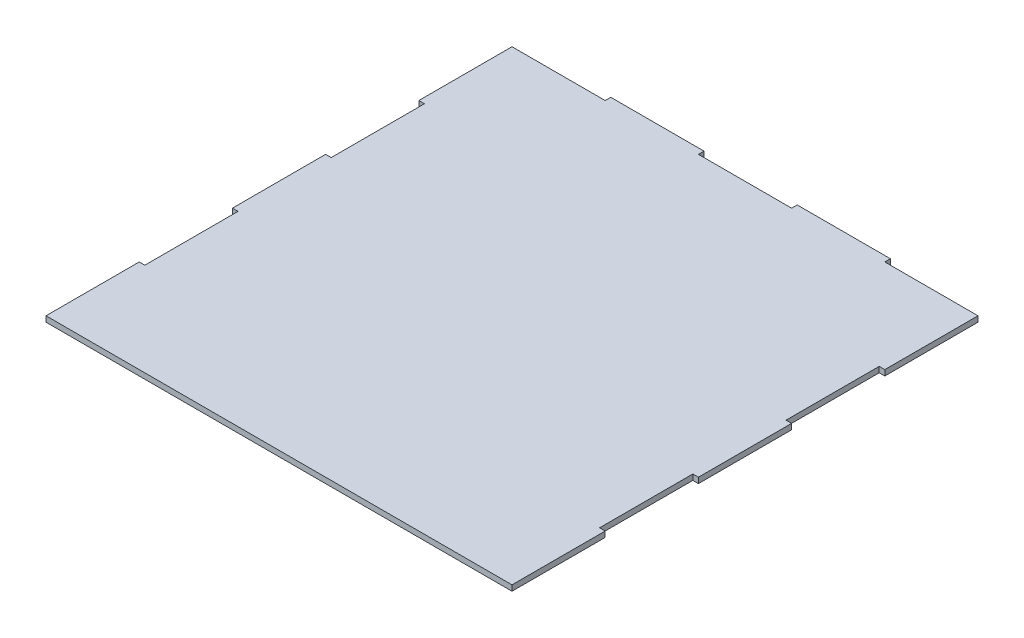
from build123d import *

# Parameters (mm, degrees)
BOSS_EXTRUDE1_DEPTH = 3


with BuildPart() as part:
    # Sketch1 → Boss-Extrude1 (new body)
    with BuildSketch(Plane(origin=(0, 0, 0), x_dir=(1, 0, 0), z_dir=(0, 1, 0))):
        Polygon((250, 100), (250, 150), (247, 150), (247, 200), (250, 200), (250, 250), (200, 250), (200, 253), (150, 253), (150, 250), (100, 250), (100, 253), (50, 253), (50, 250), (0, 250), (0, 200), (3, 200), (3, 150), (0, 150), (0, 100), (3, 100), (3, 50), (0, 50), (0, 0), (250, 0), (250, 50), (247, 50), (247, 100), align=None)
    extrude(amount=BOSS_EXTRUDE1_DEPTH)


solid = part.part
